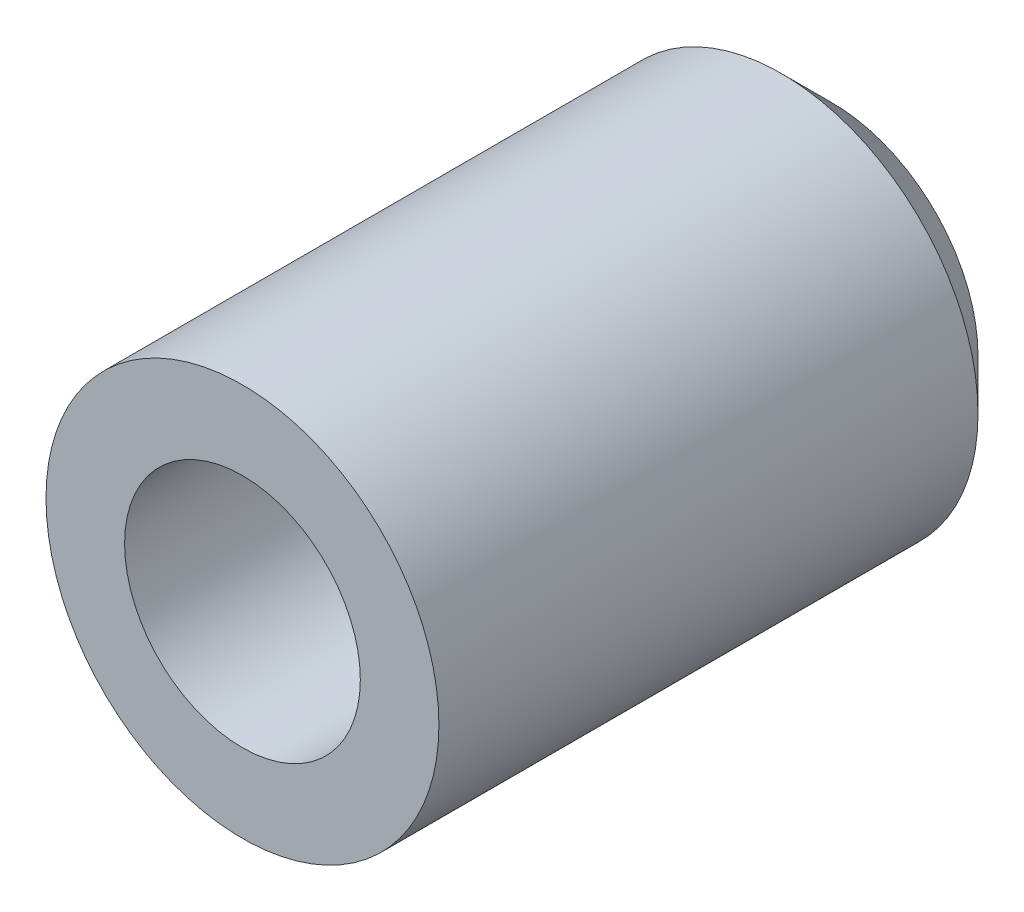
from build123d import *

# Parameters (mm, degrees)
SKETCH1_R           = 7.9375
SKETCH1_R_2         = 4.7625
BOSS_EXTRUDE1_DEPTH = 11.90625
CHAMFER1_SIZE       = 2.032


with BuildPart() as part:
    # Sketch1 → Boss-Extrude1 (new, symmetric)
    with BuildSketch(Plane.XY):
        Circle(SKETCH1_R)
        Circle(SKETCH1_R_2, mode=Mode.SUBTRACT)
    extrude(amount=BOSS_EXTRUDE1_DEPTH, both=True)

    # Chamfer1
    chamfer1_edges = [part.edges().sort_by_distance(p)[0] for p in [
        (-7.9375, 0, -11.90625),
    ]]
    chamfer(chamfer1_edges, length=CHAMFER1_SIZE)


solid = part.part
